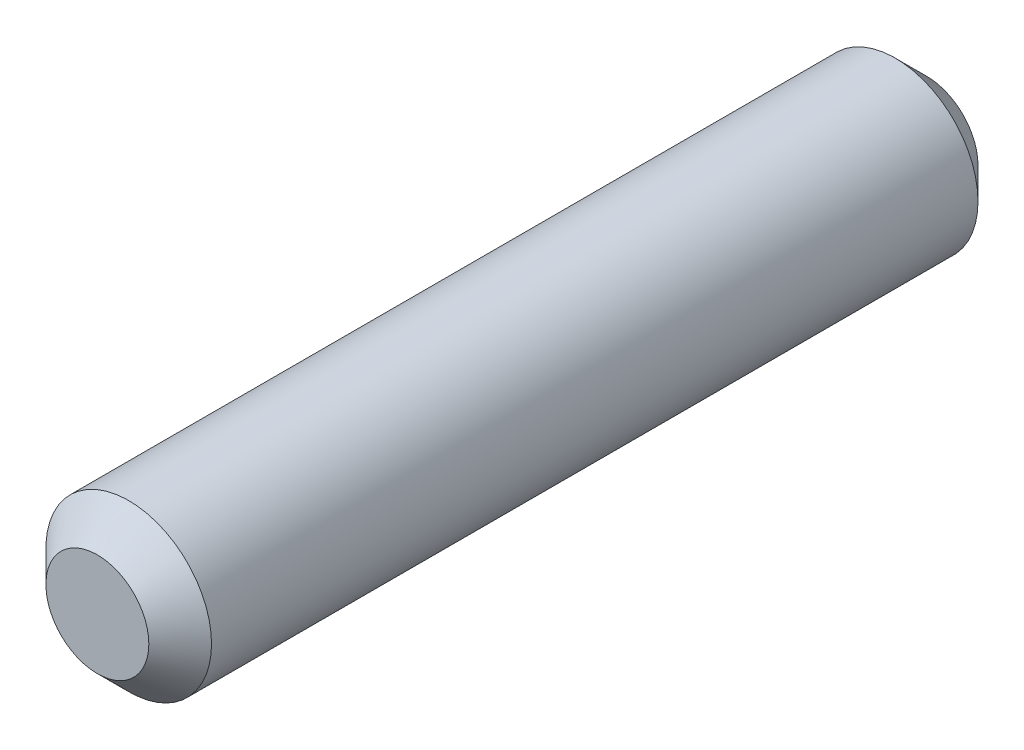
from build123d import *

# Parameters (mm, degrees)
SKETCH1_R           = 1.585
BOSS_EXTRUDE1_DEPTH = 7.935
CHAMFER1_SIZE       = 0.6


with BuildPart() as part:
    # Sketch1 → Boss-Extrude1 (new, symmetric)
    with BuildSketch(Plane.XY):
        Circle(SKETCH1_R)
    extrude(amount=BOSS_EXTRUDE1_DEPTH, both=True)

    # Chamfer1
    chamfer1_edges = [part.edges().sort_by_distance(p)[0] for p in [
        (-1.585, 0, -7.935),
        (-1.585, 0, 7.935),
    ]]
    chamfer(chamfer1_edges, length=CHAMFER1_SIZE)


solid = part.part
